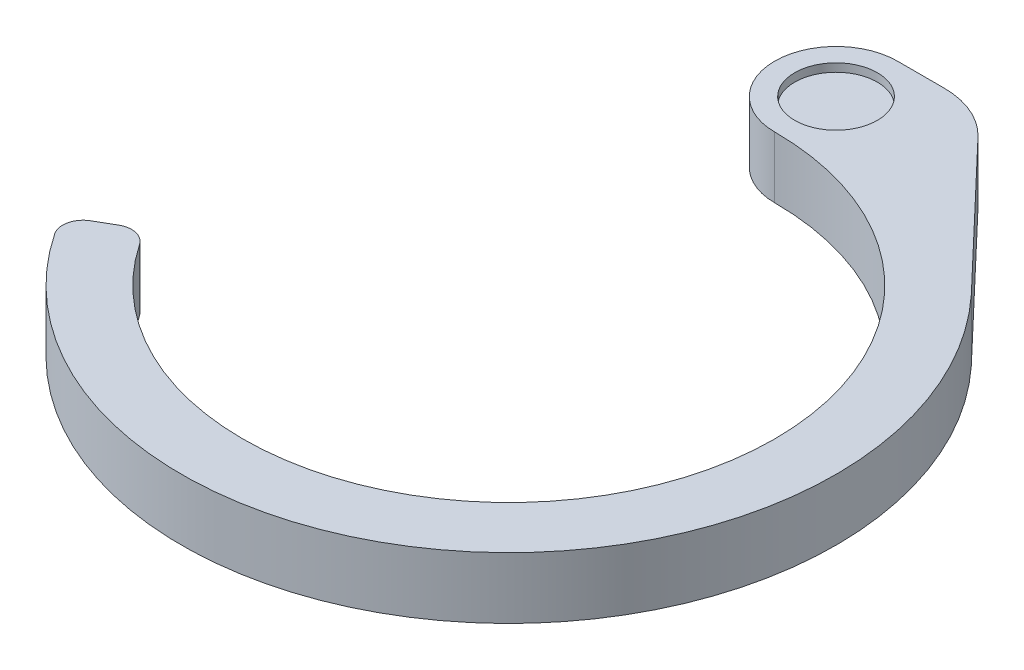
from build123d import *

# Parameters (mm, degrees)
EXTRUDE_4_DEPTH     = 15
SKETCH_3_R          = 10.1
CUT_EXTRUDE_1_DEPTH = 2


with BuildPart() as part:
    # ｽｹｯﾁ2 → ﾎﾞｽ - 押し出し4 (new body)
    with BuildSketch(Plane(origin=(0, 0, 0), x_dir=(1, 0, 0), z_dir=(0, 1, 0))):
        with BuildLine():
            ThreePointArc((-53.82643789, -36.437818048), (-56.846261527, -34.367935813), (-60.466933112, -34.910600109))
            Line((-60.466933112, -34.910600109), (-64.807406984, -37.416573868))
            ThreePointArc((-64.807406984, -37.416573868), (-67.177509772, -40.614402853), (-66.461234116, -44.529814279))
            ThreePointArc((-66.461234116, -44.529814279), (49.665387485, -62.716419588), (58.57572973, 54.487465409))
            Line((58.57572973, 54.487465409), (57.289371136, 55.838409315))
            Line((57.289371136, 55.838409315), (25.911523347, 88.791671712))
            ThreePointArc((25.911523347, 88.791671712), (19.306695871, 93.382511176), (11.427401304, 95))
            Line((11.427401304, 95), (0, 95))
            ThreePointArc((0, 95), (-15, 80), (0, 65))
            ThreePointArc((0, 65), (57.41714976, -30.467538684), (-53.82643789, -36.437818048))
        make_face()
    extrude(amount=EXTRUDE_4_DEPTH)

    # ｽｹｯﾁ3 → ｶｯﾄ - 押し出し1 (cut)
    with BuildSketch(Plane(origin=(0, 15, 0), x_dir=(1, 0, 0), z_dir=(0, 1, 0))):
        with Locations(Location((0, 80, 0), (0, 0, 270))):
            Circle(SKETCH_3_R)
    extrude(amount=-CUT_EXTRUDE_1_DEPTH, mode=Mode.SUBTRACT)


solid = part.part
